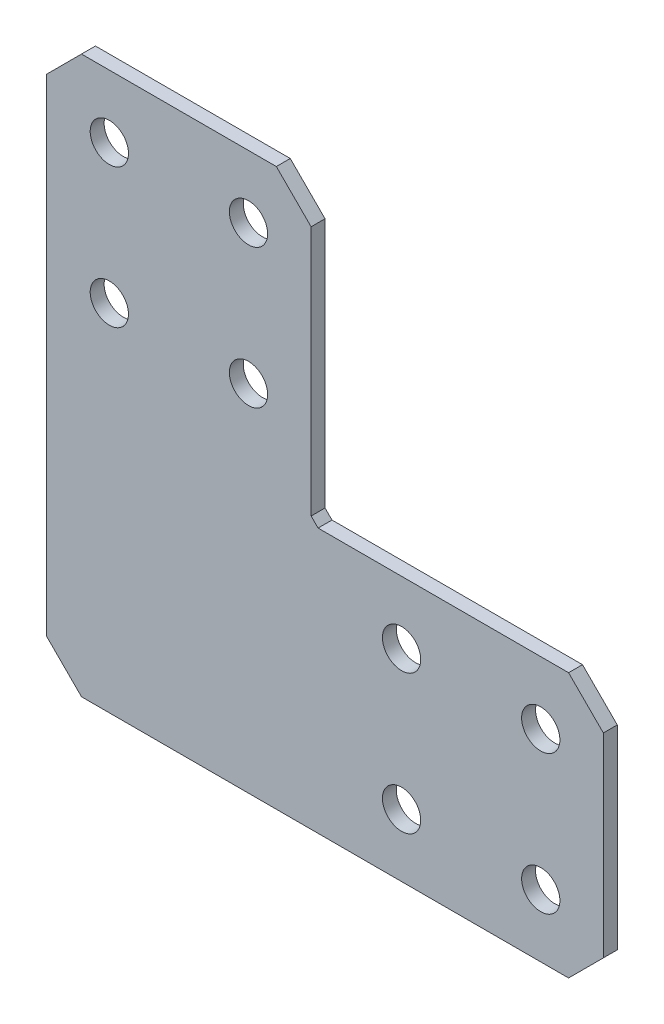
from build123d import *

# Parameters (mm, degrees)
SKETCH1_R           = 2.75
BOSS_EXTRUDE1_DEPTH = 2


with BuildPart() as part:
    # Sketch1 → Boss-Extrude1 (new body)
    with BuildSketch(Plane.XY):
        Polygon((5, 0), (38, 0), (75, 0), (80, 5), (80, 33), (75, 38), (39, 38), (38, 39), (38, 75), (33, 80), (5, 80), (0, 75), (0, 5), align=None)
        with Locations((9, 71)):
            Circle(SKETCH1_R, mode=Mode.SUBTRACT)
        with Locations((29, 71)):
            Circle(SKETCH1_R, mode=Mode.SUBTRACT)
        with Locations((29, 51)):
            Circle(SKETCH1_R, mode=Mode.SUBTRACT)
        with Locations((9, 51)):
            Circle(SKETCH1_R, mode=Mode.SUBTRACT)
        with Locations((51, 29)):
            Circle(SKETCH1_R, mode=Mode.SUBTRACT)
        with Locations((71, 29)):
            Circle(SKETCH1_R, mode=Mode.SUBTRACT)
        with Locations((71, 9)):
            Circle(SKETCH1_R, mode=Mode.SUBTRACT)
        with Locations((51, 9)):
            Circle(SKETCH1_R, mode=Mode.SUBTRACT)
    extrude(amount=BOSS_EXTRUDE1_DEPTH)


solid = part.part
